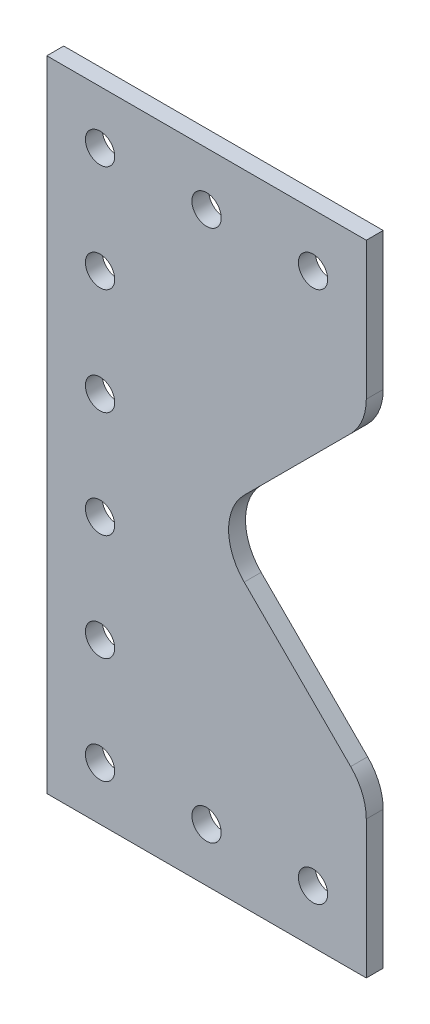
from build123d import *

# Parameters (mm, degrees)
BOSS_EXTRUDE1_DEPTH  = 3.175
M5_CLEARANCE_HOLE1_D = 5.5
LPATTERN1_COUNT      = 3
LPATTERN1_PITCH      = 20
LPATTERN2_COUNT      = 6
LPATTERN2_PITCH      = 20
FILLET2_R            = 10
LPATTERN3_COPY_1_D   = 5.5
LPATTERN3_COPY_2_D   = 5.5
LPATTERN3_COPY_3_D   = 5.5


with BuildPart() as part:
    # Sketch1 → Boss-Extrude1 (new body)
    with BuildSketch(Plane.XY):
        Polygon((0, 0), (0, 120), (60, 120), (60, 90), (30, 60), (60, 30), (60, 0), align=None)
    extrude(amount=BOSS_EXTRUDE1_DEPTH)

    # M5 Clearance Hole1 (through all)
    with Locations(Plane(origin=(10, 10, 3.175), x_dir=(1, 0, 0), z_dir=(0, 0, 1))):
        with Locations((0, 0)):
            m5_clearance_hole1 = Hole(M5_CLEARANCE_HOLE1_D / 2)

    # LPattern1: M5 Clearance Hole1 ×3
    with Locations(*[(i * LPATTERN1_PITCH, 0, 0) for i in range(1, LPATTERN1_COUNT)]):
        add(m5_clearance_hole1, mode=Mode.SUBTRACT)

    # LPattern2: M5 Clearance Hole1 ×6
    with Locations(*[(0, i * LPATTERN2_PITCH, 0) for i in range(1, LPATTERN2_COUNT)]):
        add(m5_clearance_hole1, mode=Mode.SUBTRACT)

    # Fillet2
    fillet2_edges = [part.edges().sort_by_distance(p)[0] for p in [
        (60, 90, 1.5875),
        (30, 60, 1.5875),
        (60, 30, 1.5875),
    ]]
    fillet(fillet2_edges, radius=FILLET2_R)

    # LPattern3 copy 1 (through all)
    with Locations(Plane(origin=(30, 110, 3.175), x_dir=(1, 0, 0), z_dir=(0, 0, 1))):
        with Locations((0, 0)):
            Hole(LPATTERN3_COPY_1_D / 2)

    # LPattern3 copy 2 (through all)
    with Locations(Plane(origin=(50, 110, 3.175), x_dir=(1, 0, 0), z_dir=(0, 0, 1))):
        with Locations((0, 0)):
            Hole(LPATTERN3_COPY_2_D / 2)

    # LPattern3 copy 3 (through all)
    with Locations(Plane(origin=(10, 110, 3.175), x_dir=(1, 0, 0), z_dir=(0, 0, 1))):
        with Locations((0, 0)):
            Hole(LPATTERN3_COPY_3_D / 2)


solid = part.part
